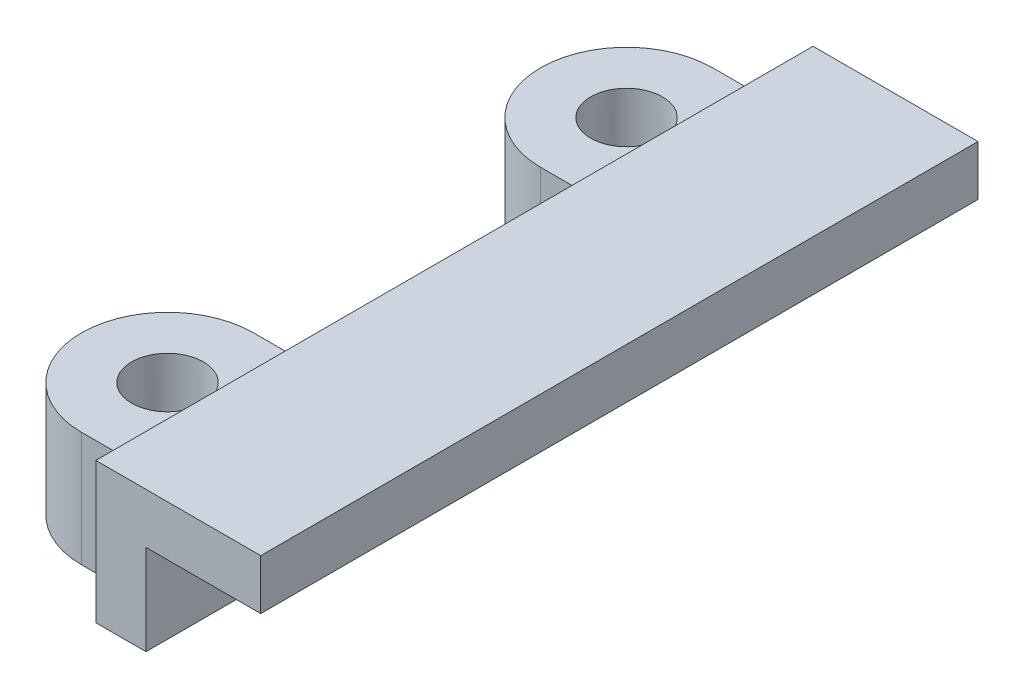
from build123d import *

# Parameters (mm, degrees)
CROQUIS4_W                = 13
CROQUIS4_H                = 9.8
SALIENTE_EXTRUIR1_DEPTH   = 161
CROQUIS5_W                = 151
CROQUIS5_H                = 3.5
CORTAR_EXTRUIR1_DEPTH     = 6.3
SALIENTE_EXTRUIR3_DEPTH   = 8
CROQUIS9_R                = 2.5
CORTAR_EXTRUIR3_DEPTH     = 179.42936978
SIMETR_A8_COPY_1_DEPTH    = 8
SIMETR_A8_COPY_2_SKETCH_R = 2.5
SIMETR_A8_COPY_2_DEPTH    = 179.42936978
CROQUIS10_R               = 2.5
CORTAR_EXTRUIR4_DEPTH     = 179.42936978
MATRIZL1_COUNT            = 3
MATRIZL1_PITCH            = 40.5
CROQUIS11_W               = 64.853728184
CROQUIS11_H               = 22.965019475
CORTAR_EXTRUIR5_DEPTH     = 168.44040731
CROQUIS12_W               = 8
CROQUIS12_H               = 6.3
CORTAR_EXTRUIR6_DEPTH     = 44.226612174


with BuildPart() as part:
    # Barrer1: sweep along a path in Croquis3
    with BuildLine(Plane(origin=(0, 0, 0), x_dir=(1, 0, 0), z_dir=(0, 1, 0))) as barrer1_path:
        Line((0, 0), (0, -37))
    # Croquis1 → Barrer1 (sweep)
    with BuildSketch(Plane.XY):
        Polygon((0, 0), (0, 9.8), (11.5, 9.8), (11.5, 6.3), (3.5, 6.3), (3.5, 0), align=None)
    barrer1 = sweep(path=barrer1_path.line)

    # Croquis4 → Saliente-Extruir1 (add)
    with BuildSketch(Plane.ZY):
        with Locations((43.5, 4.9)):
            Rectangle(CROQUIS4_W, CROQUIS4_H)
    extrude(amount=-SALIENTE_EXTRUIR1_DEPTH)

    # Simetría5: Barrer1 across plane
    add(barrer1.mirror(Plane.ZY.offset(-80.5)))

    # Croquis5 → Cortar-Extruir1 (cut)
    with BuildSketch(Plane.XZ):
        with Locations((79, 38.75)):
            Rectangle(CROQUIS5_W, CROQUIS5_H)
    extrude(amount=-CORTAR_EXTRUIR1_DEPTH, mode=Mode.SUBTRACT)

    # Croquis8 → Saliente-Extruir3 (add)
    with BuildSketch(Plane.XZ):
        with BuildLine():
            Line((161, 47), (165, 47))
            ThreePointArc((165, 47), (171, 41), (165, 35))
            Line((165, 35), (161, 35))
            Line((161, 35), (161, 47))
        make_face()
    saliente_extruir3 = extrude(amount=-SALIENTE_EXTRUIR3_DEPTH)

    # Croquis9 → Cortar-Extruir3 (cut, through all)
    with BuildSketch(Plane.XZ):
        with Locations((165, 41)):
            Circle(CROQUIS9_R)
    cortar_extruir3 = extrude(amount=-CORTAR_EXTRUIR3_DEPTH, mode=Mode.SUBTRACT)

    # Simetría7: Saliente-Extruir3, Cortar-Extruir3 across plane
    add(saliente_extruir3.mirror(Plane(origin=(0, 0, 25), x_dir=(1, 0, 0), z_dir=(0, 0, -1))))
    add(cortar_extruir3.mirror(Plane(origin=(0, 0, 25), x_dir=(1, 0, 0), z_dir=(0, 0, -1))), mode=Mode.SUBTRACT)

    # Simetría8: Saliente-Extruir3, Cortar-Extruir3 across plane
    add(saliente_extruir3.mirror(Plane.ZY.offset(-80.5)))
    add(cortar_extruir3.mirror(Plane.ZY.offset(-80.5)), mode=Mode.SUBTRACT)

    # Simetría8 copy 1 sketch → Simetría8 copy 1 (add)
    with BuildSketch(Plane(origin=(161, 0, 50), x_dir=(-1, 0, 0), z_dir=(0, -1, 0))):
        with BuildLine():
            Line((161, 47), (165, 47))
            ThreePointArc((165, 47), (171, 41), (165, 35))
            Line((165, 35), (161, 35))
            Line((161, 35), (161, 47))
        make_face()
    extrude(amount=-SIMETR_A8_COPY_1_DEPTH)

    # Simetría8 copy 2 sketch → Simetría8 copy 2 (cut, through all)
    with BuildSketch(Plane(origin=(161, 0, 50), x_dir=(-1, 0, 0), z_dir=(0, -1, 0))):
        with Locations((165, 41)):
            Circle(SIMETR_A8_COPY_2_SKETCH_R)
    extrude(amount=-SIMETR_A8_COPY_2_DEPTH, mode=Mode.SUBTRACT)

    # Croquis10 → Cortar-Extruir4 (cut, through all)
    with BuildSketch(Plane(origin=(0, 9.8, 0), x_dir=(1, 0, 0), z_dir=(0, 1, 0))):
        with Locations(Location((121, -45.25, 0), (0, 0, 270))):
            Circle(CROQUIS10_R)
    cortar_extruir4 = extrude(amount=-CORTAR_EXTRUIR4_DEPTH, mode=Mode.SUBTRACT)

    # MatrizL1: Cortar-Extruir4 ×3
    with Locations(*[(-i * MATRIZL1_PITCH, 0, 0) for i in range(1, MATRIZL1_COUNT)]):
        add(cortar_extruir4, mode=Mode.SUBTRACT)

    # Croquis11 → Cortar-Extruir5 (cut, through all)
    with BuildSketch(Plane(origin=(11.5, 0, 0), x_dir=(0, 0, -1), z_dir=(1, 0, 0))):
        with Locations((-26.956517022, 7.895183468)):
            Rectangle(CROQUIS11_W, CROQUIS11_H)
    extrude(amount=CORTAR_EXTRUIR5_DEPTH, mode=Mode.SUBTRACT)

    # Croquis12 → Cortar-Extruir6 (cut, through all)
    with BuildSketch(Plane(origin=(0, 0, 40.5), x_dir=(-1, 0, 0), z_dir=(0, 0, -1))):
        with Locations((-7.5, 3.15)):
            Rectangle(CROQUIS12_W, CROQUIS12_H)
    extrude(amount=-CORTAR_EXTRUIR6_DEPTH, mode=Mode.SUBTRACT)


solid = part.part
